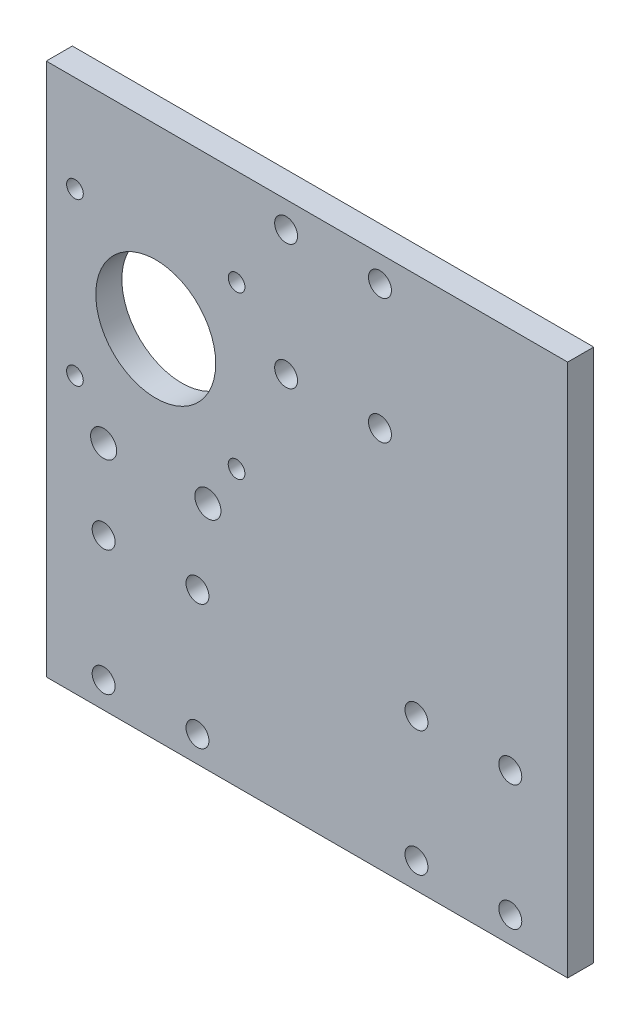
from build123d import *

# Parameters (mm, degrees)
SKETCH1_W           = 100
SKETCH1_H           = 102.3
BOSS_EXTRUDE1_DEPTH = 5
SKETCH4_R           = 2.2
CUT_EXTRUDE1_DEPTH  = 5
LPATTERN1_COUNT     = 2
LPATTERN1_PITCH     = 60
SKETCH6_R           = 1.6
SKETCH6_R_2         = 11.5
CUT_EXTRUDE4_DEPTH  = 10
SKETCH8_R           = 2.2
CUT_EXTRUDE5_DEPTH  = 10
SKETCH9_R           = 2.5
CUT_EXTRUDE6_DEPTH  = 10


with BuildPart() as part:
    # Sketch1 → Boss-Extrude1 (new body)
    with BuildSketch(Plane.XY):
        Rectangle(SKETCH1_W, SKETCH1_H)
    extrude(amount=BOSS_EXTRUDE1_DEPTH)

    # Sketch4 → Cut-Extrude1 (cut)
    with BuildSketch(Plane.XY.offset(5)):
        with Locations((39, -22.15)):
            Circle(SKETCH4_R)
        with Locations((39, -46.15)):
            Circle(SKETCH4_R)
        with Locations((21, -46.15)):
            Circle(SKETCH4_R)
        with Locations((21, -22.15)):
            Circle(SKETCH4_R)
    cut_extrude1 = extrude(amount=-CUT_EXTRUDE1_DEPTH, mode=Mode.SUBTRACT)

    # LPattern1: Cut-Extrude1 ×2
    with Locations(*[(-i * LPATTERN1_PITCH, 0, 0) for i in range(1, LPATTERN1_COUNT)]):
        add(cut_extrude1, mode=Mode.SUBTRACT)

    # Sketch6 → Cut-Extrude4 (cut)
    with BuildSketch(Plane.XY.offset(5)):
        with Locations((-44.499679494, 32.649679494)):
            Circle(SKETCH6_R)
        with Locations((-13.49967952, 32.650961002)):
            Circle(SKETCH6_R)
        with Locations((-44.499680011, 1.649679494)):
            Circle(SKETCH6_R)
        with Locations((-13.5, 1.65)):
            Circle(SKETCH6_R)
        with Locations((-29, 17.15)):
            Circle(SKETCH6_R_2)
    extrude(amount=-CUT_EXTRUDE4_DEPTH, mode=Mode.SUBTRACT)

    # Sketch8 → Cut-Extrude5 (cut)
    with BuildSketch(Plane.XY.offset(5)):
        with Locations((-4, 46.15)):
            Circle(SKETCH8_R)
        with Locations((14, 46.15)):
            Circle(SKETCH8_R)
        with Locations((-4, 22.15)):
            Circle(SKETCH8_R)
        with Locations((14, 22.15)):
            Circle(SKETCH8_R)
    extrude(amount=-CUT_EXTRUDE5_DEPTH, mode=Mode.SUBTRACT)

    # Sketch9 → Cut-Extrude6 (cut)
    with BuildSketch(Plane.XY.offset(5)):
        with Locations((-39, -6.85)):
            Circle(SKETCH9_R)
        with Locations((-19, -6.85)):
            Circle(SKETCH9_R)
    extrude(amount=-CUT_EXTRUDE6_DEPTH, mode=Mode.SUBTRACT)


solid = part.part
